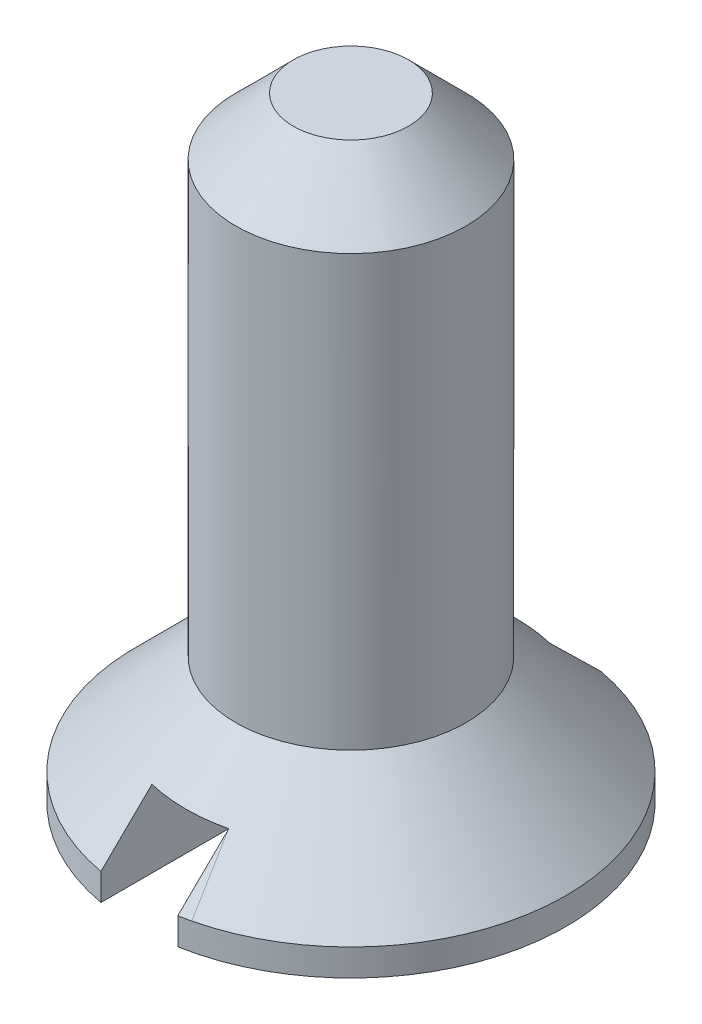
from build123d import *

# Parameters (mm, degrees)
SKETCH_1_W          = 1.5
SKETCH_1_H          = 6.35
SKETCH_2_W          = 1
SKETCH_2_H          = 1
CUT_EXTRUDE_1_DEPTH = 10
CHAMFER_1_SIZE      = 0.75


with BuildPart() as part:
    # Эскиз1 → Повернуть1 (revolve)
    with BuildSketch(Plane.XY):
        with Locations((-0.75, 4.825)):
            Rectangle(SKETCH_1_W, SKETCH_1_H)
        Polygon((-2.8, 0), (0, 0), (0, 1.65), (-1.5, 1.65), (-2.8, 0.35), align=None)
    revolve(axis=Axis((0, 8, 0), (0, -1, 0)))

    # Эскиз2 → Вырез-Вытянуть1 (cut, symmetric)
    with BuildSketch(Plane.XY):
        with Locations((0, 0.5)):
            Rectangle(SKETCH_2_W, SKETCH_2_H)
    extrude(amount=CUT_EXTRUDE_1_DEPTH, both=True, mode=Mode.SUBTRACT)

    # Фаска1
    chamfer_1_edges = [part.edges().sort_by_distance(p)[0] for p in [
        (1.5, 8, 0),
    ]]
    chamfer(chamfer_1_edges, length=CHAMFER_1_SIZE)


solid = part.part
